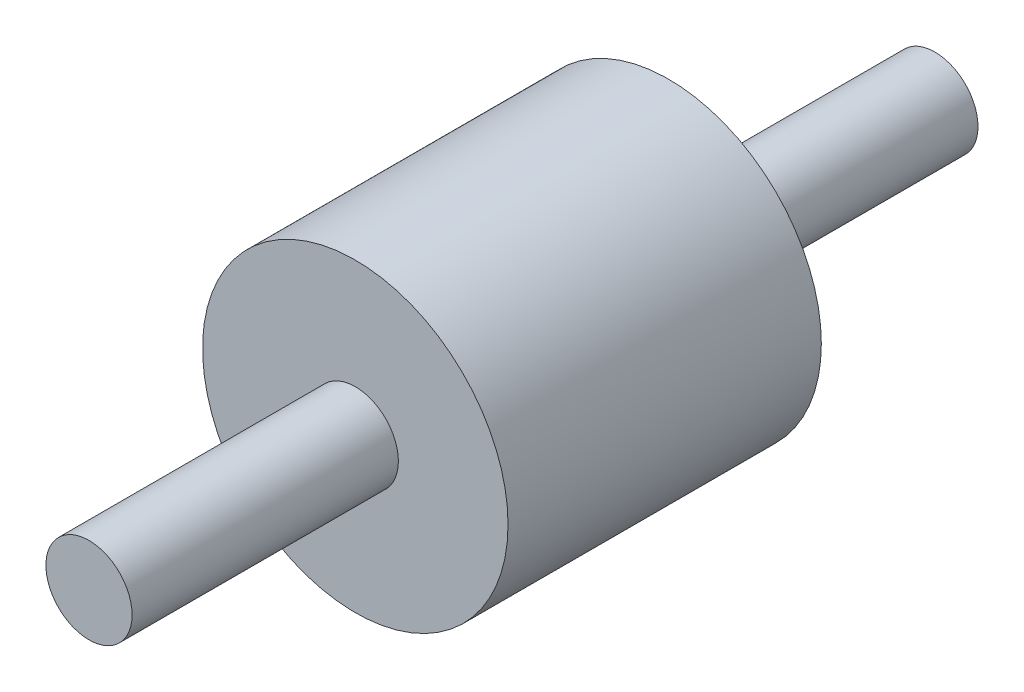
from build123d import *

# Parameters (mm, degrees)
SKETCH1_R                = 9.75
BOSS_EXTRUDE1_DEPTH      = 20
BOSS_EXTRUDE2_DEPTH      = 17
BOSS_EXTRUDE2_DEPTH_BACK = 37
SKETCH2_R                = 2.75


with BuildPart() as part:
    # Sketch1 → Boss-Extrude1 (new body)
    with BuildSketch(Plane.XY):
        Circle(SKETCH1_R)
    extrude(amount=BOSS_EXTRUDE1_DEPTH)

    # Sketch2 → Boss-Extrude2 (add, two sides: drawn at the far end of the back side and taken through both)
    with BuildSketch(Plane.XY.offset(20).offset(-BOSS_EXTRUDE2_DEPTH_BACK)):
        Circle(SKETCH2_R)
    extrude(amount=BOSS_EXTRUDE2_DEPTH + BOSS_EXTRUDE2_DEPTH_BACK)


solid = part.part
